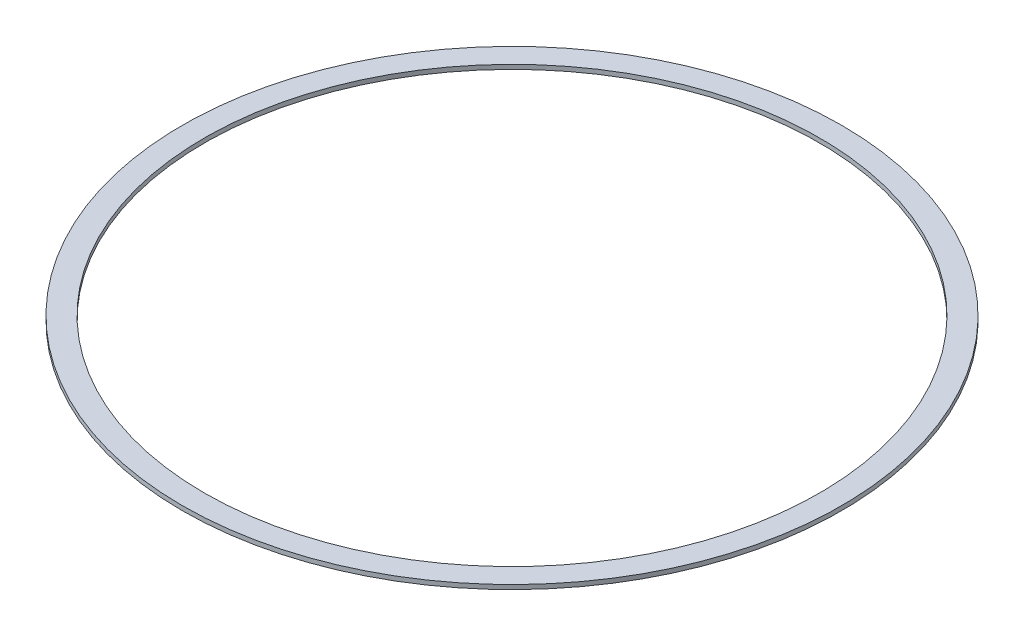
from build123d import *

# Parameters (mm, degrees)
SKETCH1_R           = 225
SKETCH1_R_2         = 210
BOSS_EXTRUDE1_DEPTH = 1.5


with BuildPart() as part:
    # Sketch1 → Boss-Extrude1 (new, symmetric)
    with BuildSketch(Plane(origin=(0, 0, 0), x_dir=(1, 0, 0), z_dir=(0, 1, 0))):
        with Locations(Location((0, 0, 0), (0, 0, 270))):
            Circle(SKETCH1_R)
        with Locations(Location((0, 0, 0), (0, 0, 270))):
            Circle(SKETCH1_R_2, mode=Mode.SUBTRACT)
    extrude(amount=BOSS_EXTRUDE1_DEPTH, both=True)


solid = part.part
